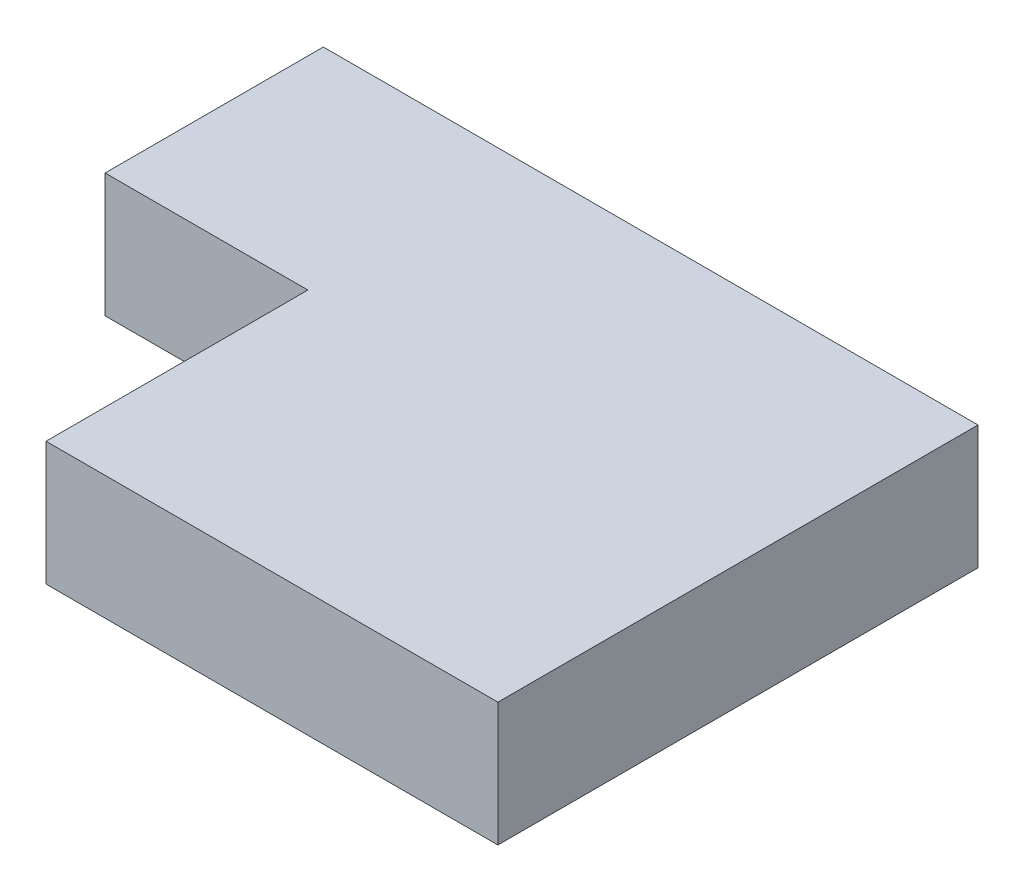
from build123d import *

# Parameters (mm, degrees)
SKETCH1_W           = 33.866666666
SKETCH1_H           = 25.4
BOSS_EXTRUDE1_DEPTH = 4.800000052
SKETCH3_W           = 16.333333517
SKETCH3_H           = 16.933333333
CUT_EXTRUDE1_DEPTH  = 99.901754472
SKETCH4_OUTSIDE_W   = 44.386
SKETCH4_OUTSIDE_H   = 35.92
CUT_EXTRUDE3_DEPTH  = 99.901754472
CUT_EXTRUDE4_DEPTH  = 97.639789204


with BuildPart() as part:
    # Sketch1 → Boss-Extrude1 (new body)
    with BuildSketch(Plane(origin=(0, 0, 0), x_dir=(1, 0, 0), z_dir=(0, 1, 0))):
        with Locations((-75.043974065, -23.337368951)):
            Rectangle(SKETCH1_W, SKETCH1_H)
    extrude(amount=BOSS_EXTRUDE1_DEPTH)

    # Sketch3 → Cut-Extrude1 (cut, through all)
    with BuildSketch(Plane(origin=(0, 4.800000052, 0), x_dir=(1, 0, 0), z_dir=(0, 1, 0))):
        with Locations((-83.81064064, -27.570702285)):
            Rectangle(SKETCH3_W, SKETCH3_H)
    extrude(amount=-CUT_EXTRUDE1_DEPTH, mode=Mode.SUBTRACT)

    # Sketch4 outside → Cut-Extrude3 (cut, through all)
    with BuildSketch(Plane(origin=(0, 4.800000052, 0), x_dir=(1, 0, 0), z_dir=(0, 1, 0))):
        with Locations((-75.044, -23.337)):
            Rectangle(SKETCH4_OUTSIDE_W, SKETCH4_OUTSIDE_H)
        Polygon((-91.977307398, -19.104035618), (-75.643973881, -19.104035618), (-75.643973881, -29.264035618), (-58.110640732, -29.264035618), (-58.110640732, -10.637368951), (-91.977307398, -10.637368951), align=None, mode=Mode.SUBTRACT)
    extrude(amount=-CUT_EXTRUDE3_DEPTH, mode=Mode.SUBTRACT)

    # Sketch5 → Cut-Extrude4 (cut, through all)
    with BuildSketch(Plane.XZ):
        Polygon((-91.977307398, 10.637368951), (-83.510640732, 10.637368951), (-83.510640732, 16.093970394), (-83.510640732, 19.104035618), (-91.977307398, 19.104035618), align=None)
    extrude(amount=-CUT_EXTRUDE4_DEPTH, mode=Mode.SUBTRACT)


solid = part.part
